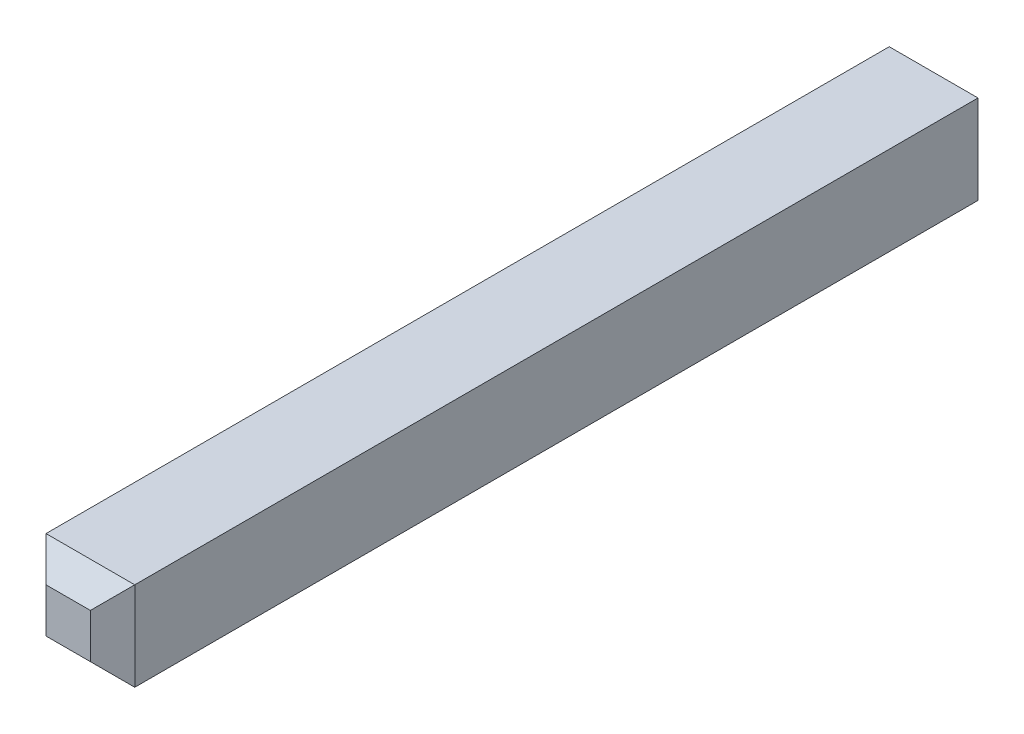
from build123d import *

# Parameters (mm, degrees)
ESQUISSE1_W        = 4
ESQUISSE1_H        = 4
BOSS_EXTRU_1_DEPTH = 40
CHANFREIN1_SIZE    = 1


with BuildPart() as part:
    # Esquisse1 → Boss.-Extru.1 (new body)
    with BuildSketch(Plane.XY):
        with Locations((2, 2)):
            Rectangle(ESQUISSE1_W, ESQUISSE1_H)
    extrude(amount=BOSS_EXTRU_1_DEPTH)

    # Chanfrein1
    chanfrein1_edges = [part.edges().sort_by_distance(p)[0] for p in [
        (4, 2, 40),
        (2, 4, 40),
        (0, 2, 40),
        (2, 4, 0),
        (4, 2, 0),
        (2, 0, 0),
        (0, 2, 0),
        (2, 0, 40),
    ]]
    chamfer(chanfrein1_edges, length=CHANFREIN1_SIZE)


solid = part.part
